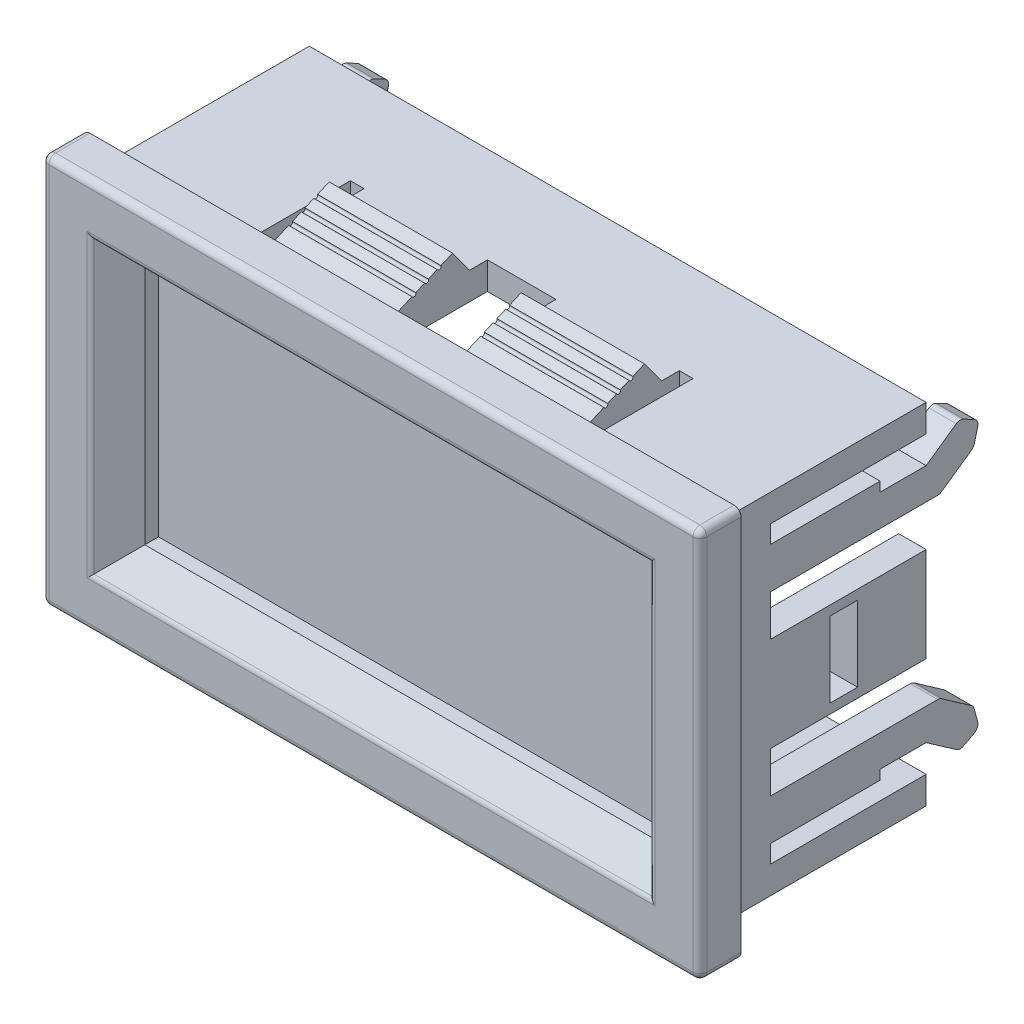
from build123d import *

# Parameters (mm, degrees)
SKETCH1_W            = 45
SKETCH1_H            = 25.5
SKETCH1_W_2          = 41
SKETCH1_H_2          = 21.5
BOSS_EXTRUDE1_DEPTH  = 15
SKETCH2_W            = 48
SKETCH2_H            = 28.5
SKETCH2_W_2          = 37
SKETCH2_H_2          = 17.5
BOSS_EXTRUDE2_DEPTH  = 3
FILLET1_R            = 0.5
FILLET2_R            = 0.5
CHAMFER1_SIZE        = 2
FILLET3_R            = 0.5
SKETCH3_W            = 39
SKETCH3_H            = 19.5
BOSS_EXTRUDE3_DEPTH  = 0.1
SKETCH4_W            = 2
SKETCH4_H            = 5.5
CUT_EXTRUDE1_DEPTH   = 7
BOSS_EXTRUDE4_DEPTH  = 2
SKETCH6_W            = 25
SKETCH6_H            = 8
CUT_EXTRUDE4_DEPTH   = 2
BOSS_EXTRUDE5_DEPTH  = 9
MIRROR5_COPY_1_DEPTH = 9


with BuildPart() as part:
    # Sketch1 → Boss-Extrude1 (new body)
    with BuildSketch(Plane.XY):
        with Locations((22.5, 12.75)):
            Rectangle(SKETCH1_W, SKETCH1_H)
        with Locations((22.5, 12.75)):
            Rectangle(SKETCH1_W_2, SKETCH1_H_2, mode=Mode.SUBTRACT)
    extrude(amount=BOSS_EXTRUDE1_DEPTH)

    # Sketch2 → Boss-Extrude2 (add)
    with BuildSketch(Plane.XY.offset(15)):
        with Locations((22.5, 12.75)):
            Rectangle(SKETCH2_W, SKETCH2_H)
        with Locations((22.5, 12.75)):
            Rectangle(SKETCH2_W_2, SKETCH2_H_2, mode=Mode.SUBTRACT)
    extrude(amount=BOSS_EXTRUDE2_DEPTH)

    # Fillet1
    fillet1_edges = [part.edges().sort_by_distance(p)[0] for p in [
        (46.5, -1.5, 16.5),
        (46.5, 27, 16.5),
        (-1.5, 27, 16.5),
        (-1.5, -1.5, 16.5),
    ]]
    fillet(fillet1_edges, radius=FILLET1_R)

    # Fillet2
    fillet2_edges = [part.edges().sort_by_distance(p)[0] for p in [
        (22.5, 27, 18),
        (46.5, 12.75, 18),
        (-1.5, 12.75, 18),
        (22.5, -1.5, 18),
        (-1.353553391, 26.853553391, 18),
        (-1.353553391, -1.353553391, 18),
        (46.353553391, -1.353553391, 18),
        (46.353553391, 26.853553391, 18),
    ]]
    fillet(fillet2_edges, radius=FILLET2_R)

    # Chamfer1
    chamfer1_edges = [part.edges().sort_by_distance(p)[0] for p in [
        (41, 12.75, 18),
        (22.5, 21.5, 18),
        (4, 12.75, 18),
        (22.5, 4, 18),
    ]]
    chamfer(chamfer1_edges, length=CHAMFER1_SIZE)

    # Fillet3
    fillet3_edges = [part.edges().sort_by_distance(p)[0] for p in [
        (22.5, 2, 18),
        (2, 12.75, 18),
        (22.5, 23.5, 18),
        (43, 12.75, 18),
    ]]
    fillet(fillet3_edges, radius=FILLET3_R)

    # Sketch3 → Boss-Extrude3 (add)
    with BuildSketch(Plane(origin=(0, 0, 15), x_dir=(-1, 0, 0), z_dir=(0, 0, -1))):
        with Locations((-22.5, 12.75)):
            Rectangle(SKETCH3_W, SKETCH3_H)
    extrude(amount=BOSS_EXTRUDE3_DEPTH)

    # Sketch4 → Cut-Extrude1 (cut)
    with BuildSketch(Plane.ZY):
        Polygon((0, 25.5), (0, 23.5), (11.354344123, 23.5), (11.354344123, 22.2), (3.354344123, 22.2), (3.354344123, 21.5), (-1.052747885, 21.5), (-1.052747885, 19.2), (11.35, 19.2), (11.35, 16.2), (-2.740421073, 16.2), (-2.133707004, 24.508604023), align=None)
        Polygon((-2.133707004, 0.991395977), (0, 0), (0, 2), (11.354344123, 2), (11.354344123, 3.3), (3.354344123, 3.3), (3.354344123, 4), (-1.052747885, 4), (-1.052747885, 6.3), (11.35, 6.3), (11.35, 9.3), (-2.740421073, 9.3), align=None)
        with Locations((6, 12.75)):
            Rectangle(SKETCH4_W, SKETCH4_H)
    cut_extrude1 = extrude(amount=-CUT_EXTRUDE1_DEPTH, mode=Mode.SUBTRACT)

    # Mirror1: Cut-Extrude1 across plane
    add(cut_extrude1.mirror(Plane(origin=(22.5, 0, 0), x_dir=(0, 0, 1), z_dir=(1, 0, 0))), mode=Mode.SUBTRACT)

    # Sketch5 → Boss-Extrude4 (add)
    with BuildSketch(Plane.ZY):
        with BuildLine():
            Line((0, 21.5), (-2.205642109, 23.044407231))
            ThreePointArc((-2.205642109, 23.044407231), (-2.462636709, 23.13394276), (-2.728457708, 23.075615822))
            Line((-2.728457708, 23.075615822), (-3.522154827, 22.650614026))
            ThreePointArc((-3.522154827, 22.650614026), (-3.745020462, 22.408367067), (-3.768996943, 22.08007176))
            Line((-3.768996943, 22.08007176), (-3.504631096, 21.096282354))
            ThreePointArc((-3.504631096, 21.096282354), (-3.431234223, 20.939104177), (-3.308549817, 20.816463984))
            Line((-3.308549817, 20.816463984), (-1.129138824, 19.290423978))
            ThreePointArc((-1.129138824, 19.290423978), (-0.992703505, 19.223141525), (-0.842350606, 19.2))
            Line((-0.842350606, 19.2), (0, 19.2))
            Line((0, 19.2), (0, 21.5))
        make_face()
        with BuildLine():
            Line((-3.522154827, 2.849385974), (-2.728457708, 2.424384178))
            ThreePointArc((-2.728457708, 2.424384178), (-2.462636709, 2.36605724), (-2.205642109, 2.455592769))
            Line((-2.205642109, 2.455592769), (0, 4))
            Line((0, 4), (0, 6.3))
            Line((0, 6.3), (-0.842350606, 6.3))
            ThreePointArc((-0.842350606, 6.3), (-0.992703505, 6.276858475), (-1.129138824, 6.209576022))
            Line((-1.129138824, 6.209576022), (-3.308549817, 4.683536016))
            ThreePointArc((-3.308549817, 4.683536016), (-3.431234223, 4.560895823), (-3.504631096, 4.403717646))
            Line((-3.504631096, 4.403717646), (-3.768996943, 3.41992824))
            ThreePointArc((-3.768996943, 3.41992824), (-3.745020462, 3.091632933), (-3.522154827, 2.849385974))
        make_face()
    boss_extrude4 = extrude(amount=-BOSS_EXTRUDE4_DEPTH)

    # Mirror3: Boss-Extrude4 across plane
    add(boss_extrude4.mirror(Plane(origin=(22.5, 0, 0), x_dir=(0, 0, 1), z_dir=(1, 0, 0))))

    # Sketch6 → Cut-Extrude4 (cut)
    with BuildSketch(Plane(origin=(0, 25.5, 0), x_dir=(1, 0, 0), z_dir=(0, 1, 0))):
        with Locations((22.5, -11)):
            Rectangle(SKETCH6_W, SKETCH6_H)
    cut_extrude4 = extrude(amount=-CUT_EXTRUDE4_DEPTH, mode=Mode.SUBTRACT)

    # Sketch7 → Boss-Extrude5 (add)
    with BuildSketch(Plane(origin=(11, 0, 0), x_dir=(0, 0, -1), z_dir=(1, 0, 0))):
        with BuildLine():
            Line((-7, 23.5), (-13.5, 23.5))
            Line((-13.5, 23.5), (-13.5, 25.5))
            Line((-13.5, 25.5), (-12.50438631, 25.92802582))
            ThreePointArc((-12.50438631, 25.92802582), (-12.308138031, 25.84987504), (-12.229830148, 26.046060684))
            Line((-12.229830148, 26.046060684), (-11.58568767, 26.322984972))
            ThreePointArc((-11.58568767, 26.322984972), (-11.389415731, 26.244779249), (-11.311131441, 26.441019864))
            Line((-11.311131441, 26.441019864), (-10.666989007, 26.717944134))
            ThreePointArc((-10.666989007, 26.717944134), (-10.47069343, 26.639683459), (-10.392432756, 26.835979036))
            Line((-10.392432756, 26.835979036), (-9.545698193, 27.2))
            Line((-9.545698193, 27.2), (-8.3, 25.5))
            Line((-8.3, 25.5), (-7, 25.5))
            Line((-7, 25.5), (-7, 23.5))
        make_face()
    boss_extrude5 = extrude(amount=BOSS_EXTRUDE5_DEPTH)

    # Mirror4: Boss-Extrude5 across plane
    add(boss_extrude5.mirror(Plane(origin=(22.5, 0, 0), x_dir=(0, 0, 1), z_dir=(1, 0, 0))))

    # Mirror5: Cut-Extrude4, Boss-Extrude5 across plane
    add(cut_extrude4.mirror(Plane.ZX.offset(12.75)), mode=Mode.SUBTRACT)
    add(boss_extrude5.mirror(Plane.ZX.offset(12.75)))

    # Mirror5 copy 1 sketch → Mirror5 copy 1 (add)
    with BuildSketch(Plane(origin=(34, 25.5, 0), x_dir=(0, 0, -1), z_dir=(-1, 0, 0))):
        with BuildLine():
            Line((-7, 23.5), (-13.5, 23.5))
            Line((-13.5, 23.5), (-13.5, 25.5))
            Line((-13.5, 25.5), (-12.50438631, 25.92802582))
            ThreePointArc((-12.50438631, 25.92802582), (-12.308138031, 25.84987504), (-12.229830148, 26.046060684))
            Line((-12.229830148, 26.046060684), (-11.58568767, 26.322984972))
            ThreePointArc((-11.58568767, 26.322984972), (-11.389415731, 26.244779249), (-11.311131441, 26.441019864))
            Line((-11.311131441, 26.441019864), (-10.666989007, 26.717944134))
            ThreePointArc((-10.666989007, 26.717944134), (-10.47069343, 26.639683459), (-10.392432756, 26.835979036))
            Line((-10.392432756, 26.835979036), (-9.545698193, 27.2))
            Line((-9.545698193, 27.2), (-8.3, 25.5))
            Line((-8.3, 25.5), (-7, 25.5))
            Line((-7, 25.5), (-7, 23.5))
        make_face()
    extrude(amount=MIRROR5_COPY_1_DEPTH)


solid = part.part
